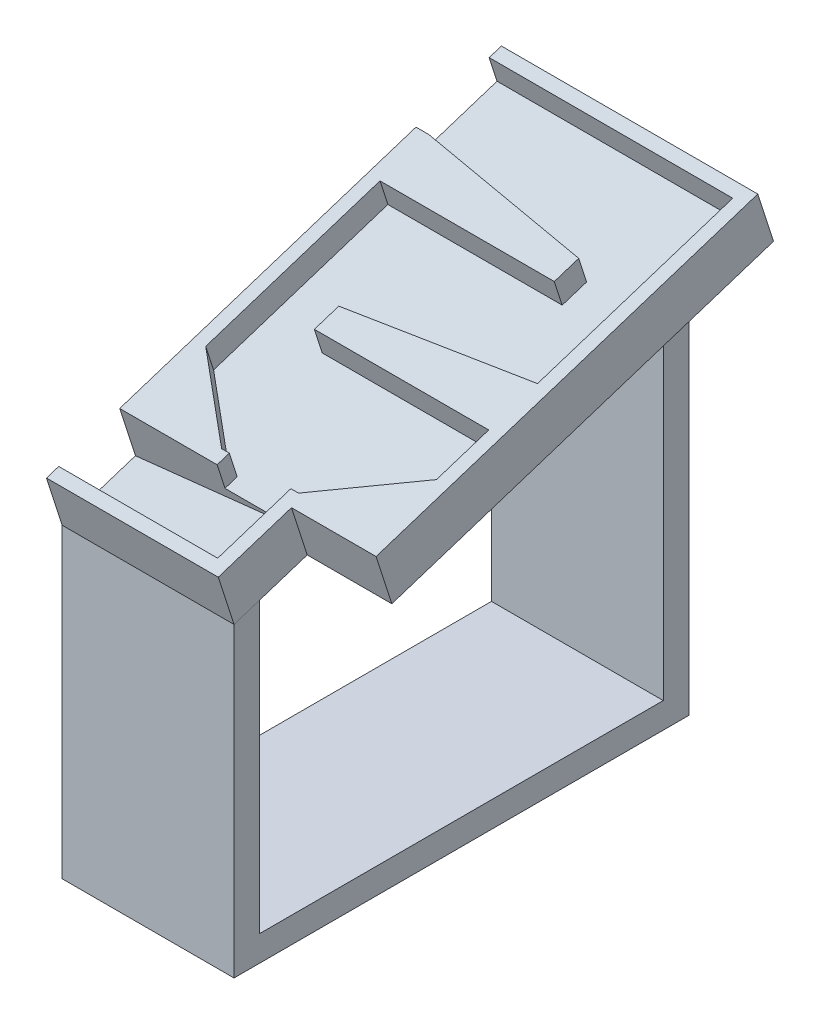
from build123d import *

# Parameters (mm, degrees)
EXTRUDE_1_DEPTH     = 50
SKETCH_2_W          = 45
SKETCH_2_H          = 73.20482035
CUT_EXTRUDE_1_DEPTH = 5
EXTRUDE_3_DEPTH     = 5
CUT_EXTRUDE_2_REACH = 95.182
SKETCH_9_W          = 12
SKETCH_9_H          = 5
EXTRUDE_4_DEPTH     = 15
SKETCH_13_W         = 31
SKETCH_13_H         = 10
EXTRUDE_5_DEPTH     = 2.5
EXTRUDE_6_DEPTH     = 2.5
CUT_EXTRUDE_3_REACH = 97.301
EXTRUDE_1_2_DEPTH   = 5
EXTRUDE_2_DEPTH     = 33.5


with BuildPart() as part:
    # Sketch 1 → Extrude 1 (new body)
    with BuildSketch(Plane(origin=(0, 0, 0), x_dir=(0, 0, -1), z_dir=(1, 0, 0))):
        Polygon((0, 0), (74.43113546, 24), (77.5, 14.482538656), (3.06886454, -9.517461344), align=None)
    extrude(amount=EXTRUDE_1_DEPTH)

    # Sketch 2 → 除料-伸長1 (cut)
    with BuildSketch(Plane(origin=(0, 0, 0), x_dir=(1, 0, 0), z_dir=(0, 0.951746134414701, 0.30688645396412334))):
        with Locations((25, 39.102410175)):
            Rectangle(SKETCH_2_W, SKETCH_2_H)
    extrude(amount=-CUT_EXTRUDE_1_DEPTH, mode=Mode.SUBTRACT)

    # 草圖7 → 填料-伸長3 (add)
    with BuildSketch(Plane(origin=(0, -4.758730672, -1.53443227), x_dir=(1, 0, 0), z_dir=(0, 0.951746134414701, 0.30688645396412323))):
        Polygon((2.5, 15), (17.5, 2.5), (2.5, 2.5), align=None)
        Polygon((47.5, 2.5), (47.5, 15), (32.5, 2.5), align=None)
    extrude(amount=EXTRUDE_3_DEPTH)

    # 草圖9 → 除料-伸長2 (cut, up to next)
    with BuildSketch(Plane(origin=(0, 0.767216135, -2.379365336), x_dir=(-1, 0, 0), z_dir=(0, 0.30688645396412334, -0.951746134414701)), mode=Mode.PRIVATE) as cut_extrude_2_sk1:
        with Locations((-25, -2.5)):
            Rectangle(SKETCH_9_W, SKETCH_9_H)
    cut_extrude_2_tool1 = extrude(cut_extrude_2_sk1.sketch, amount=-CUT_EXTRUDE_2_REACH, mode=Mode.PRIVATE) & part.part
    add(cut_extrude_2_tool1.solids().sort_by_distance((25, -1.612149, -3.146581))[0], mode=Mode.SUBTRACT)

    # 草圖11 → 填料-伸長4 (add)
    with BuildSketch(Plane(origin=(0, 0, 0), x_dir=(1, 0, 0), z_dir=(0, -0.3068864539641233, 0.951746134414701))):
        Polygon((0, -10), (31, -5), (31, -10), align=None)
    extrude(amount=EXTRUDE_4_DEPTH)

    # 草圖13 → 填料-伸長5 (add)
    with BuildSketch(Plane(origin=(0, -4.603296809, 14.276192016), x_dir=(1, 0, 0), z_dir=(0, -0.3068864539641233, 0.951746134414701))):
        with Locations((15.5, -5)):
            Rectangle(SKETCH_13_W, SKETCH_13_H)
    extrude(amount=-EXTRUDE_5_DEPTH)

    # 草圖14 → 填料-伸長6 (add)
    with BuildSketch(Plane(origin=(31, 0, 0), x_dir=(0, 0, -1), z_dir=(1, 0, 0))):
        Polygon((-14.276192016, -4.603296809), (0, 0), (3.06886454, -9.517461344), (-11.207327477, -14.120758154), align=None)
    extrude(amount=EXTRUDE_6_DEPTH)

    # 草圖15 → 除料-伸長3 (cut, up to next)
    with BuildSketch(Plane.ZY, mode=Mode.PRIVATE) as cut_extrude_3_sk1:
        Polygon((-72.051770124, 23.232783865), (-73.586202394, 18.474053193), (-59.310010378, 13.870756384), (-57.775578108, 18.629487056), align=None)
    cut_extrude_3_tool1 = extrude(cut_extrude_3_sk1.sketch, amount=-CUT_EXTRUDE_3_REACH, mode=Mode.PRIVATE) & part.part
    add(cut_extrude_3_tool1.solids().sort_by_distance((0, 18.55177, -65.68089))[0], mode=Mode.SUBTRACT)

    # Sketch 1 2 → Extrude 1 2 (add)
    with BuildSketch(Plane(origin=(0, -4.758730672, -1.53443227), x_dir=(1, 0, 0), z_dir=(0, 0.951746134414701, 0.30688645396412323))):
        Polygon((2.5, 60.70482035), (36.5, 55.70482035), (36.5, 50.70482035), (2.5, 50.70482035), align=None)
        Polygon((47.5, 25.70482035), (13.5, 25.70482035), (13.5, 30.70482035), (47.5, 35.70482035), align=None)
    extrude(amount=EXTRUDE_1_2_DEPTH)


with BuildPart() as body_2:
    # Sketch 2 2 → Extrude 2 (new body)
    with BuildSketch(Plane.ZY):
        Polygon((-77.5, 14.482538656), (-77.5, -73.827595212), (11.207327477, -73.827595212), (11.207327477, -14.120758154), (6.207327477, -12.508529625), (6.207327477, -68.827595212), (-72.5, -68.827595212), (-72.5, 12.870310127), align=None)
    extrude(amount=-EXTRUDE_2_DEPTH)


solid = Compound([part.part, body_2.part])
